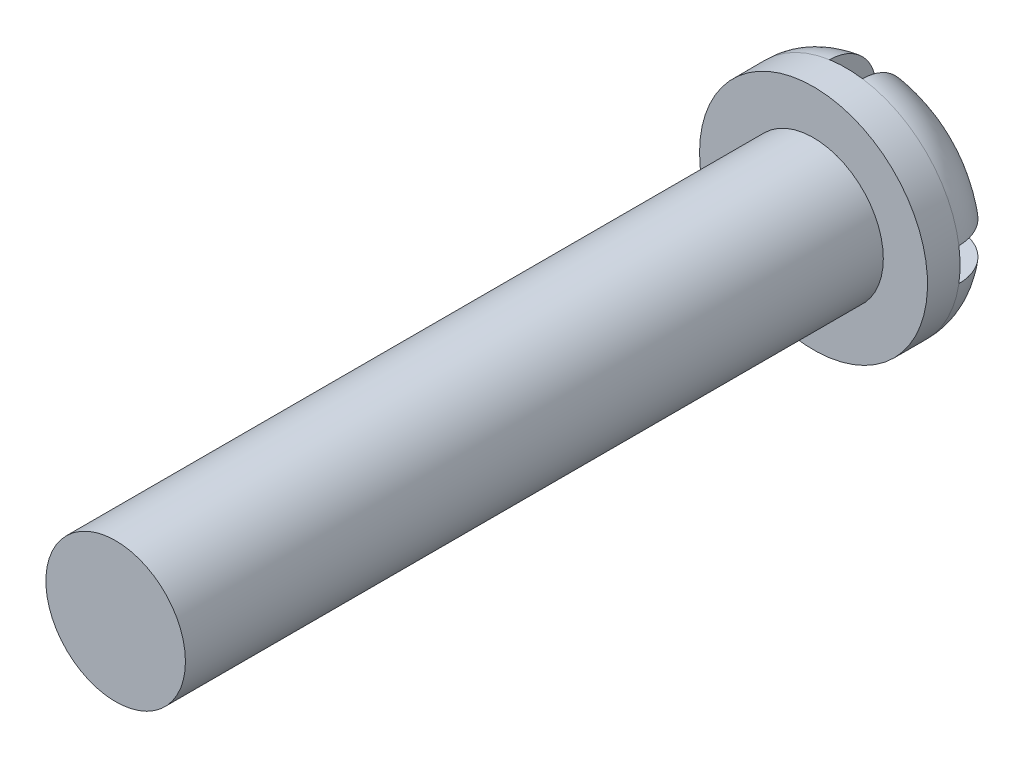
from build123d import *

# Parameters (mm, degrees)
SKETCH_1_R          = 3
EXTRUDE_1_DEPTH     = 30
SKETCH_2_R          = 4.9
EXTRUDE_2_DEPTH     = 3.4
FILLET_1_R          = 2
CUT_EXTRUDE_1_DEPTH = 2


with BuildPart() as part:
    # 草图1 → 凸台-拉伸1 (new body)
    with BuildSketch(Plane.XY):
        Circle(SKETCH_1_R)
    extrude(amount=EXTRUDE_1_DEPTH)

    # 草图2 → 凸台-拉伸2 (add)
    with BuildSketch(Plane(origin=(0, 0, 0), x_dir=(-1, 0, 0), z_dir=(0, 0, -1))):
        Circle(SKETCH_2_R)
    extrude(amount=EXTRUDE_2_DEPTH)

    # 圆角1
    fillet_1_edges = [part.edges().sort_by_distance(p)[0] for p in [
        (4.9, 0, -3.4),
    ]]
    fillet(fillet_1_edges, radius=FILLET_1_R)

    # 草图3 → 切除-拉伸1 (cut)
    with BuildSketch(Plane(origin=(0, 0, -3.4), x_dir=(-1, 0, 0), z_dir=(0, 0, -1))):
        Polygon((-0.707106781, 0.707106781), (-0.707106781, 6.006401657), (0.707106781, 6.006401657), (0.707106781, 0.707106781), (6.006401657, 0.707106781), (6.006401657, -0.707106781), (0.707106781, -0.707106781), (0.707106781, -6.006401657), (-0.707106781, -6.006401657), (-0.707106781, -0.707106781), (-6.006401657, -0.707106781), (-6.006401657, 0.707106781), align=None)
    extrude(amount=-CUT_EXTRUDE_1_DEPTH, mode=Mode.SUBTRACT)


solid = part.part
